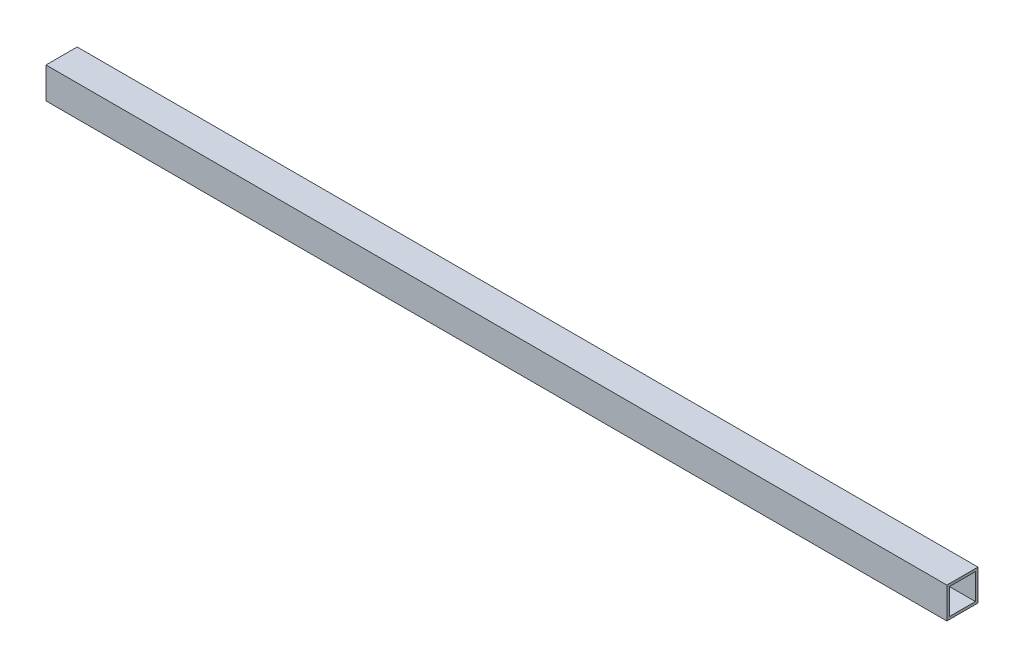
from build123d import *

# Parameters (mm, degrees)
SKETCH1_W                        = 38.1
SKETCH1_H                        = 38.1
SKETCH1_W_2                      = 31.75
SKETCH1_H_2                      = 31.75
BOSS_EXTRUDE1_DEPTH              = 1101.725
F_10_0_1935_DIAMETER_HOLE1_D     = 4.9149
F_10_0_1935_DIAMETER_HOLE1_DEPTH = 3.175


with BuildPart() as part:
    # Sketch1 → Boss-Extrude1 (new body)
    with BuildSketch(Plane(origin=(0, 0, 0), x_dir=(0, 0, -1), z_dir=(1, 0, 0))):
        with Locations((19.05, 19.05)):
            Rectangle(SKETCH1_W, SKETCH1_H)
        with Locations((19.05, 19.05)):
            Rectangle(SKETCH1_W_2, SKETCH1_H_2, mode=Mode.SUBTRACT)
    extrude(amount=BOSS_EXTRUDE1_DEPTH)

    # #10 (0.1935) Diameter Hole1
    with Locations(Plane.XZ):
        with Locations((260.35, -19.05), (869.95, -19.05)):
            Hole(F_10_0_1935_DIAMETER_HOLE1_D / 2, depth=F_10_0_1935_DIAMETER_HOLE1_DEPTH)


solid = part.part
